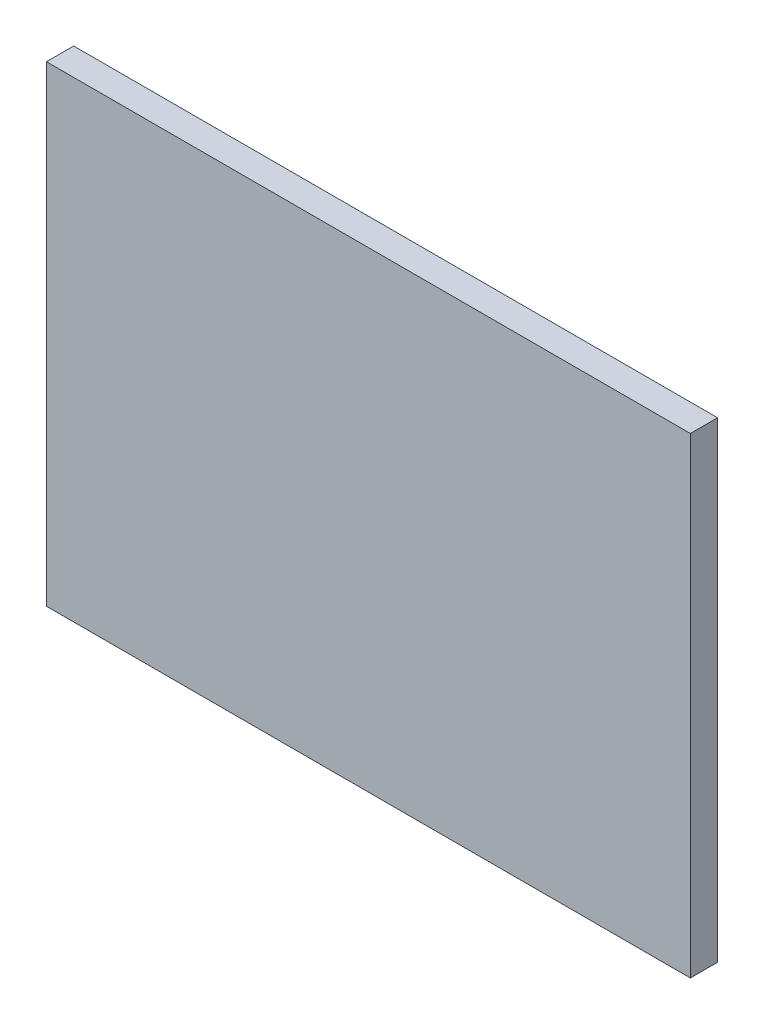
from build123d import *

# Parameters (mm, degrees)
SKETCH_1_W      = 71
SKETCH_1_H      = 52
EXTRUDE_1_DEPTH = 3


with BuildPart() as part:
    # 草图1 → 凸台-拉伸1 (new body)
    with BuildSketch(Plane.XY):
        Rectangle(SKETCH_1_W, SKETCH_1_H)
    extrude(amount=EXTRUDE_1_DEPTH)


solid = part.part
